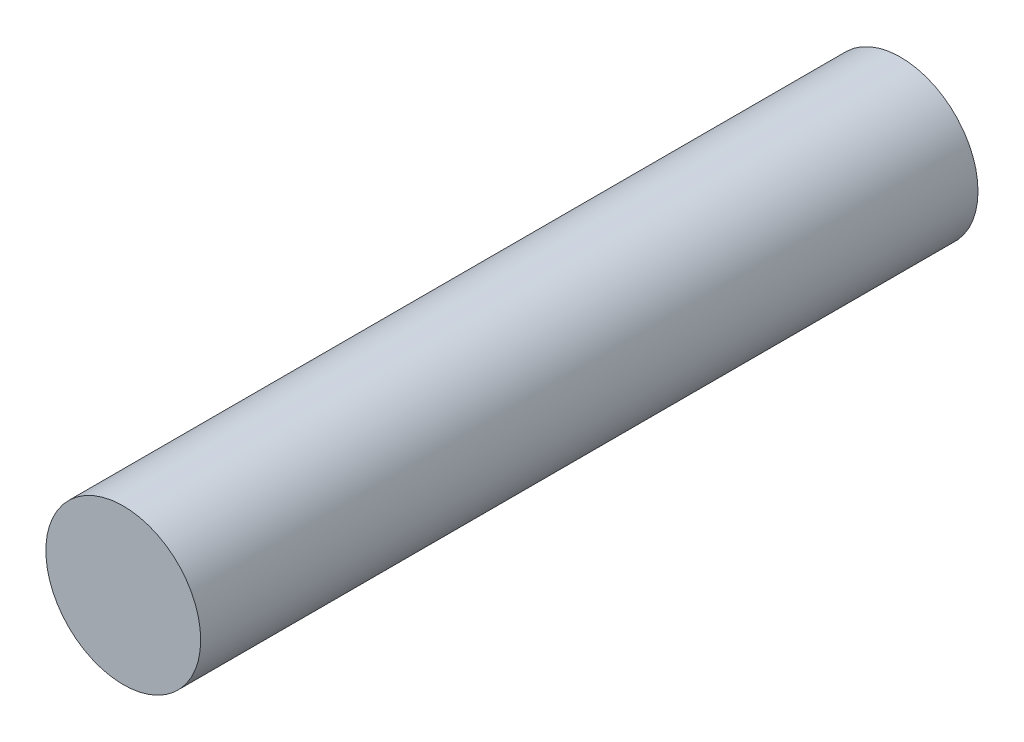
from build123d import *

# Parameters (mm, degrees)
BOSS_EXTRUDE1_DEPTH      = 15
BOSS_EXTRUDE1_DEPTH_BACK = 10
SKETCH1_R                = 2.49


with BuildPart() as part:
    # Sketch1 → Boss-Extrude1 (new, two sides: drawn at the far end of the back side and taken through both)
    with BuildSketch(Plane.XY.offset(-BOSS_EXTRUDE1_DEPTH_BACK)):
        Circle(SKETCH1_R)
    extrude(amount=BOSS_EXTRUDE1_DEPTH + BOSS_EXTRUDE1_DEPTH_BACK)


solid = part.part
